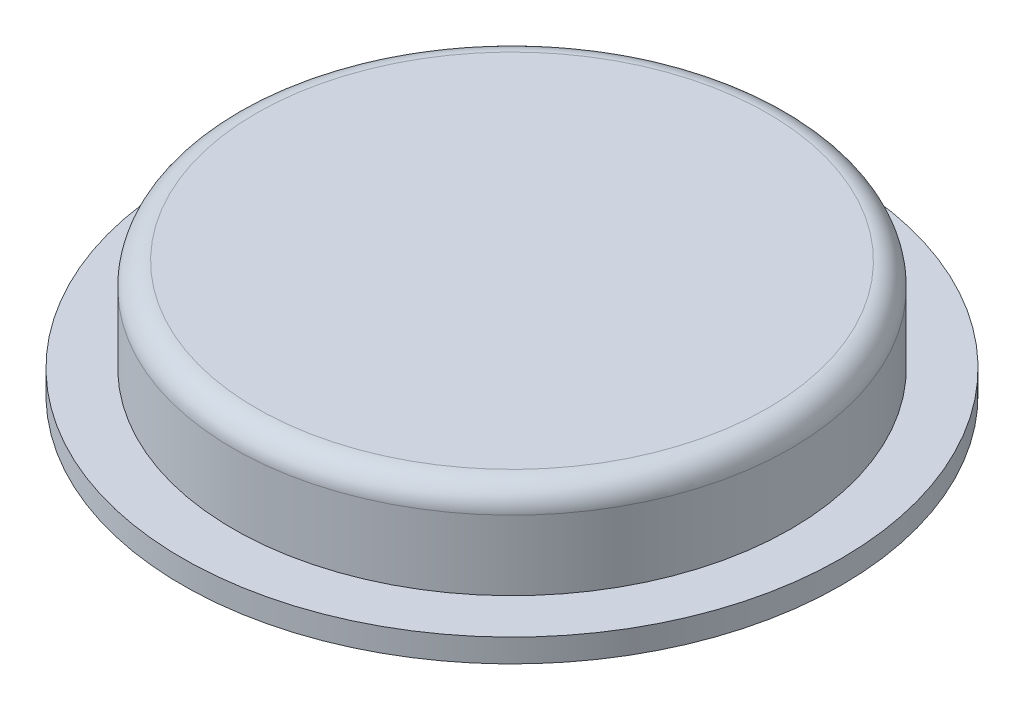
from build123d import *

# Parameters (mm, degrees)
FILLET_1_R = 0.5


with BuildPart() as part:
    # Эскиз1 → Повернуть1 (revolve)
    with BuildSketch(Plane.XY):
        Polygon((-5.295963856, 0), (-7.091803279, 0), (-7.091803279, 0.5), (-6, 0.5), (-6, 2.5), (0, 2.5), (0, 1.340599242), (-5.295963856, 1.340599242), align=None)
    revolve(axis=Axis((0, 2.5, 0), (0, -1, 0)))

    # Скругление1
    fillet_1_edges = [part.edges().sort_by_distance(p)[0] for p in [
        (6, 2.5, 0),
    ]]
    fillet(fillet_1_edges, radius=FILLET_1_R)


solid = part.part
